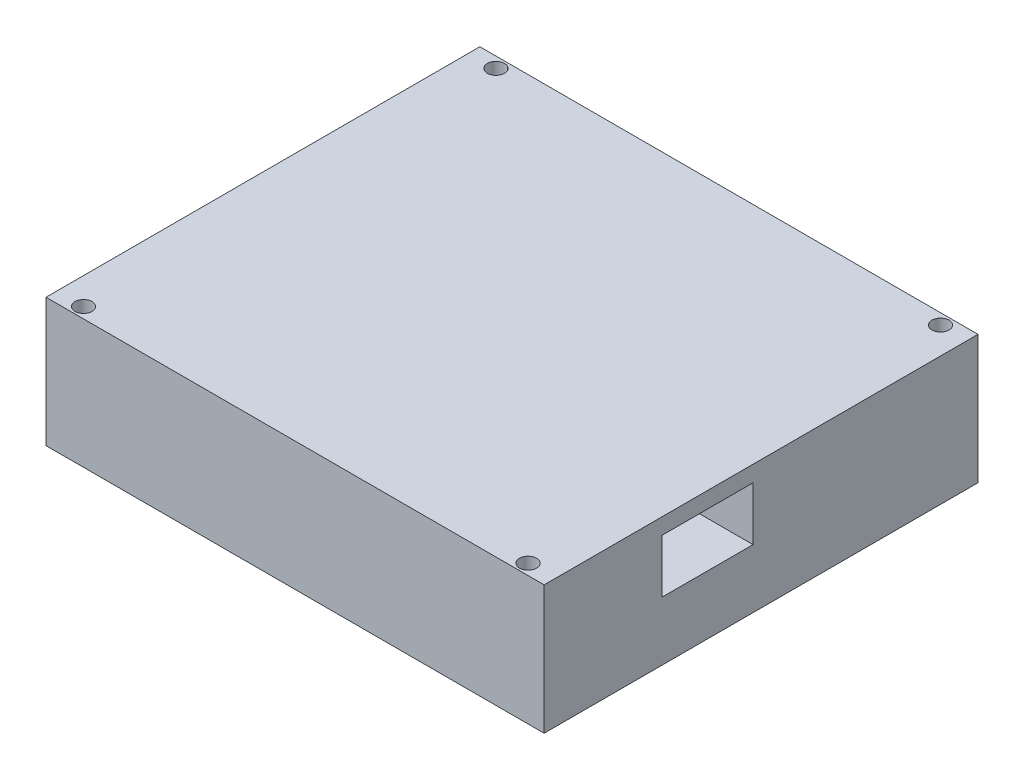
from build123d import *

# Parameters (mm, degrees)
SKETCH1_W           = 93
SKETCH1_H           = 81
BOSS_EXTRUDE1_DEPTH = 24
SKETCH2_R           = 1.6
CUT_EXTRUDE1_DEPTH  = 24
SKETCH3_W           = 17
SKETCH3_H           = 10
CUT_EXTRUDE2_DEPTH  = 20


with BuildPart() as part:
    # Sketch1 → Boss-Extrude1 (new body)
    with BuildSketch(Plane(origin=(0, 0, 0), x_dir=(1, 0, 0), z_dir=(0, 1, 0))):
        Rectangle(SKETCH1_W, SKETCH1_H)
    extrude(amount=BOSS_EXTRUDE1_DEPTH)

    # Sketch2 → Cut-Extrude1 (cut)
    with BuildSketch(Plane(origin=(0, 24, 0), x_dir=(1, 0, 0), z_dir=(0, 1, 0))):
        with Locations(Location((-41.5, 38.5, 0), (0, 0, 270))):
            Circle(SKETCH2_R)
        with Locations(Location((-41.5, -38.5, 0), (0, 0, 90))):
            Circle(SKETCH2_R)
        with Locations(Location((41.5, -38.5, 0), (0, 0, 270))):
            Circle(SKETCH2_R)
        with Locations(Location((41.5, 38.5, 0), (0, 0, 90))):
            Circle(SKETCH2_R)
    extrude(amount=-CUT_EXTRUDE1_DEPTH, mode=Mode.SUBTRACT)

    # Sketch3 → Cut-Extrude2 (cut)
    with BuildSketch(Plane(origin=(46.5, 0, 0), x_dir=(0, 0, -1), z_dir=(1, 0, 0))):
        with Locations((-10, 16)):
            Rectangle(SKETCH3_W, SKETCH3_H)
    extrude(amount=-CUT_EXTRUDE2_DEPTH, mode=Mode.SUBTRACT)


solid = part.part
